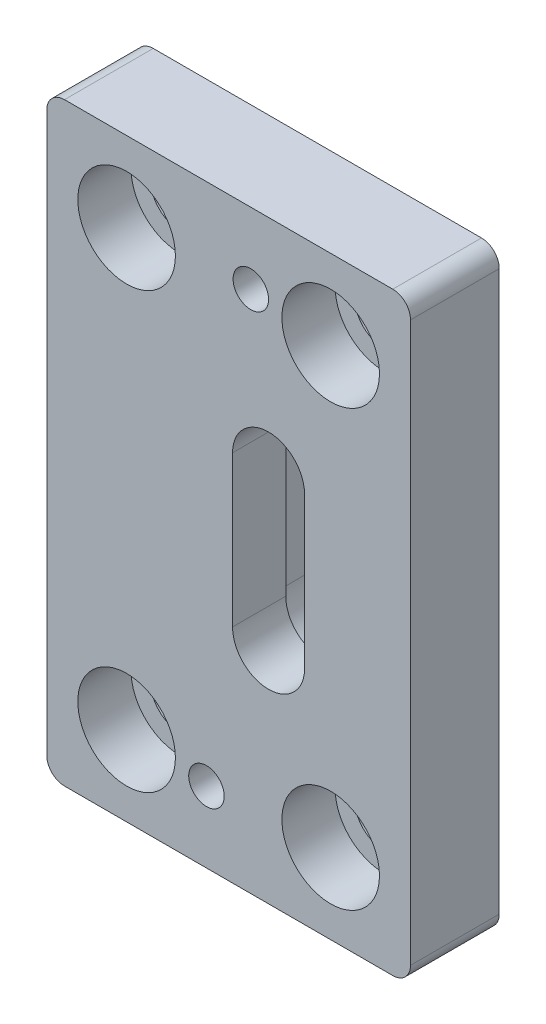
from build123d import *

# Parameters (mm, degrees)
BOSS_EXTRUDE1_DEPTH             = 10
CUT_EXTRUDE1_START              = -6
CUT_EXTRUDE1_DEPTH              = 4
CBORE_FOR_M6_SHCS1_D            = 6.6
CBORE_FOR_M6_SHCS1_CBORE_D      = 11
CBORE_FOR_M6_SHCS1_CBORE_DEPTH  = 6
F_4_0MM_CLEARANCE_DOWEL_HOLE1_D = 4


with BuildPart() as part:
    # Sketch2 → Boss-Extrude1 (new body)
    with BuildSketch(Plane.XY):
        with BuildLine():
            Line((-23, 47), (14, 47))
            ThreePointArc((14, 47), (15.414213562, 46.414213562), (16, 45))
            Line((16, 45), (16, -18))
            ThreePointArc((16, -18), (15.414213562, -19.414213562), (14, -20))
            Line((14, -20), (-23, -20))
            ThreePointArc((-23, -20), (-24.414213562, -19.414213562), (-25, -18))
            Line((-25, -18), (-25, 45))
            ThreePointArc((-25, 45), (-24.414213562, 46.414213562), (-23, 47))
        make_face()
        with BuildLine():
            Line((-4.06, 22), (-4.06, 5))
            ThreePointArc((-4.06, 5), (0, 0.94), (4.06, 5))
            Line((4.06, 5), (4.06, 22))
            ThreePointArc((4.06, 22), (0, 26.06), (-4.06, 22))
        make_face(mode=Mode.SUBTRACT)
    extrude(amount=-BOSS_EXTRUDE1_DEPTH)

    # Sketch3 → Cut-Extrude1 (cut)
    with BuildSketch(Plane.XY.offset(CUT_EXTRUDE1_START)):
        with BuildLine():
            Line((-5.06, 22), (-5.06, 5))
            ThreePointArc((-5.06, 5), (0, -0.06), (5.06, 5))
            Line((5.06, 5), (5.06, 22))
            ThreePointArc((5.06, 22), (0, 27.06), (-5.06, 22))
        make_face()
    extrude(amount=-CUT_EXTRUDE1_DEPTH, mode=Mode.SUBTRACT)

    # CBORE for M6 SHCS1 (through all)
    with Locations(Plane(origin=(0, 0, 0), x_dir=(0.9063077870366375, -0.4226182617407263, 0), z_dir=(0, 0, 1))):
        with Locations((-30.560418539, 27.67780372), (10.992955388, -7.011057825), (-9.852123713, -16.731277845), (-9.715339437, 37.39802374)):
            CounterBoreHole(CBORE_FOR_M6_SHCS1_D / 2, CBORE_FOR_M6_SHCS1_CBORE_D / 2, CBORE_FOR_M6_SHCS1_CBORE_DEPTH)

    # Ø4.0mm Clearance Dowel Hole1 (through all)
    with Locations(Plane(origin=(0, 0, 0), x_dir=(0.9063077870366375, -0.4226182617407263, 0), z_dir=(0, 0, 1))):
        with Locations((-18.294727782, 34.500767171), (-1.272735368, -13.834021277)):
            Hole(F_4_0MM_CLEARANCE_DOWEL_HOLE1_D / 2)


solid = part.part
